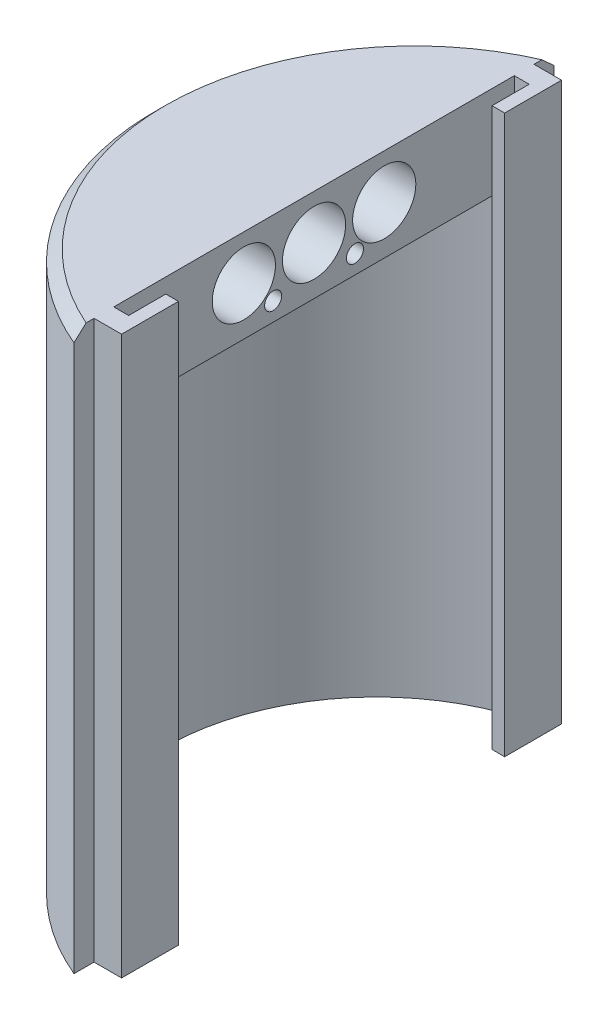
from build123d import *

# Parameters (mm, degrees)
ESQUISSE1_R             = 70
BOSS_EXTRU_1_DEPTH      = 150
ENL_V_MAT_EXTRU_1_DEPTH = 150
ENL_V_MAT_EXTRU_2_DEPTH = 180.008379692
ESQUISSE4_R             = 2.3
ENL_V_MAT_EXTRU_3_DEPTH = 20
ENL_V_MAT_EXTRU_4_DEPTH = 125
CHANFREIN1_SIZE         = 3
ESQUISSE6_R             = 8.5
ENL_V_MAT_EXTRU_5_DEPTH = 50


with BuildPart() as part:
    # Esquisse1 → Boss.-Extru.1 (new body)
    with BuildSketch(Plane(origin=(0, 0, 0), x_dir=(1, 0, 0), z_dir=(0, 1, 0))):
        with Locations(Location((0, 0, 0), (0, 0, 270))):
            Circle(ESQUISSE1_R)
    extrude(amount=-BOSS_EXTRU_1_DEPTH)

    # Esquisse2 → Enlèv. mat.-Extru.1 (cut)
    with BuildSketch(Plane(origin=(0, 0, 0), x_dir=(1, 0, 0), z_dir=(0, 1, 0))):
        with BuildLine():
            Line((-16, 68.14690015), (-16, 62.94690015))
            Line((-16, 62.94690015), (-8, 62.94690015))
            Line((-8, 62.94690015), (-8, 47.74690015))
            Line((-8, 47.74690015), (-12.8, 47.74690015))
            Line((-12.8, 47.74690015), (-12.8, 57.44690015))
            Line((-12.8, 57.44690015), (-16, 57.44690015))
            Line((-16, 57.44690015), (-16, -57.74690015))
            Line((-16, -57.74690015), (-12.8, -57.74690015))
            Line((-12.8, -57.74690015), (-12.8, -48.04690015))
            Line((-12.8, -48.04690015), (-8, -48.04690015))
            Line((-8, -48.04690015), (-8, -62.94690015))
            Line((-8, -62.94690015), (-16, -62.94690015))
            Line((-16, -62.94690015), (-16, -68.14690015))
            ThreePointArc((-16, -68.14690015), (70, 0), (-16, 68.14690015))
        make_face()
    extrude(amount=-ENL_V_MAT_EXTRU_1_DEPTH, mode=Mode.SUBTRACT)

    # Esquisse3 → Enlèv. mat.-Extru.2 (cut, through all)
    with BuildSketch(Plane(origin=(0, 0, 0), x_dir=(1, 0, 0), z_dir=(0, 1, 0))):
        Polygon((-27, 353.626649736), (-27, 64.58327957), (-27, 59.18327957), (-19.6, 59.18327957), (-19.6, 43.88327957), (-23, 43.88327957), (-23, 53.88327957), (-27, 53.88327957), (-27, -53.88327957), (-23, -53.88327957), (-23, -43.88327957), (-19.6, -43.88327957), (-19.6, -59.18327957), (-27, -59.18327957), (-27, -64.58327957), (-27, -353.626649736), (551.086740331, -353.626649736), (551.086740331, 353.626649736), align=None)
    extrude(amount=-ENL_V_MAT_EXTRU_2_DEPTH, mode=Mode.SUBTRACT)

    # Esquisse4 → Enlèv. mat.-Extru.3 (cut)
    with BuildSketch(Plane(origin=(-27, 0, 0), x_dir=(0, 0, -1), z_dir=(1, 0, 0))):
        with Locations((-11, -20)):
            Circle(ESQUISSE4_R)
        with Locations((11, -20)):
            Circle(ESQUISSE4_R)
    extrude(amount=-ENL_V_MAT_EXTRU_3_DEPTH, mode=Mode.SUBTRACT)

    # Esquisse5 → Enlèv. mat.-Extru.4 (cut)
    with BuildSketch(Plane.XZ.offset(150)):
        with BuildLine():
            Line((-27, 53.88327957), (-27, -53.88327957))
            Line((-27, -53.88327957), (-30, -53.88327957))
            ThreePointArc((-30, -53.88327957), (-67.584422787, 0), (-30, 53.88327957))
            Line((-30, 53.88327957), (-27, 53.88327957))
        make_face()
    extrude(amount=-ENL_V_MAT_EXTRU_4_DEPTH, mode=Mode.SUBTRACT)

    # Chanfrein1
    chanfrein1_edges = [part.edges().sort_by_distance(p)[0] for p in [
        (-70, 0, 0),
    ]]
    chamfer(chanfrein1_edges, length=CHANFREIN1_SIZE)

    # Esquisse6 → Enlèv. mat.-Extru.5 (cut)
    with BuildSketch(Plane(origin=(-27, 0, 0), x_dir=(0, 0, -1), z_dir=(1, 0, 0))):
        with Locations((-18.88327957, -12)):
            Circle(ESQUISSE6_R)
        with Locations((18.88327957, -12)):
            Circle(ESQUISSE6_R)
        with Locations((-0.00327957, -12)):
            Circle(ESQUISSE6_R)
    extrude(amount=-ENL_V_MAT_EXTRU_5_DEPTH, mode=Mode.SUBTRACT)


solid = part.part
